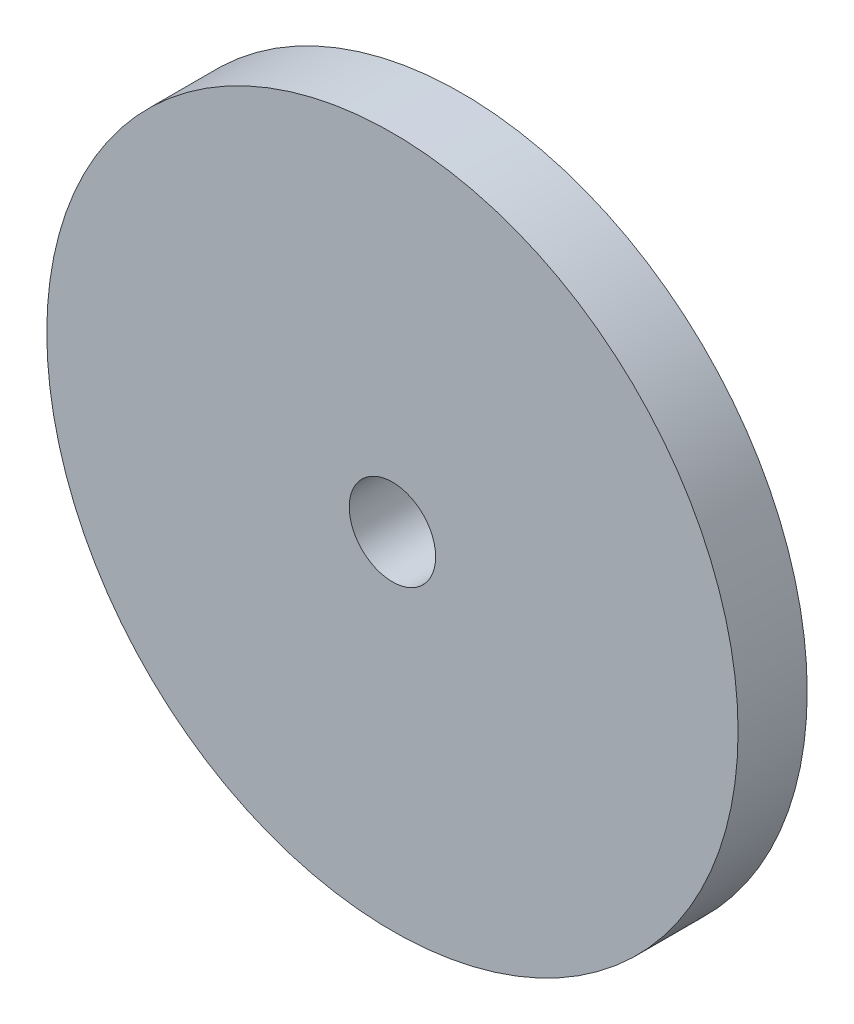
from build123d import *

# Parameters (mm, degrees)
ESBO_O1_R                = 20
ESBO_O1_R_2              = 2.5
RESSALTO_EXTRUS_O1_DEPTH = 4


with BuildPart() as part:
    # Esboço1 → Ressalto-extrusão1 (new body)
    with BuildSketch(Plane.XY):
        Circle(ESBO_O1_R)
        Circle(ESBO_O1_R_2, mode=Mode.SUBTRACT)
    extrude(amount=RESSALTO_EXTRUS_O1_DEPTH)


solid = part.part
